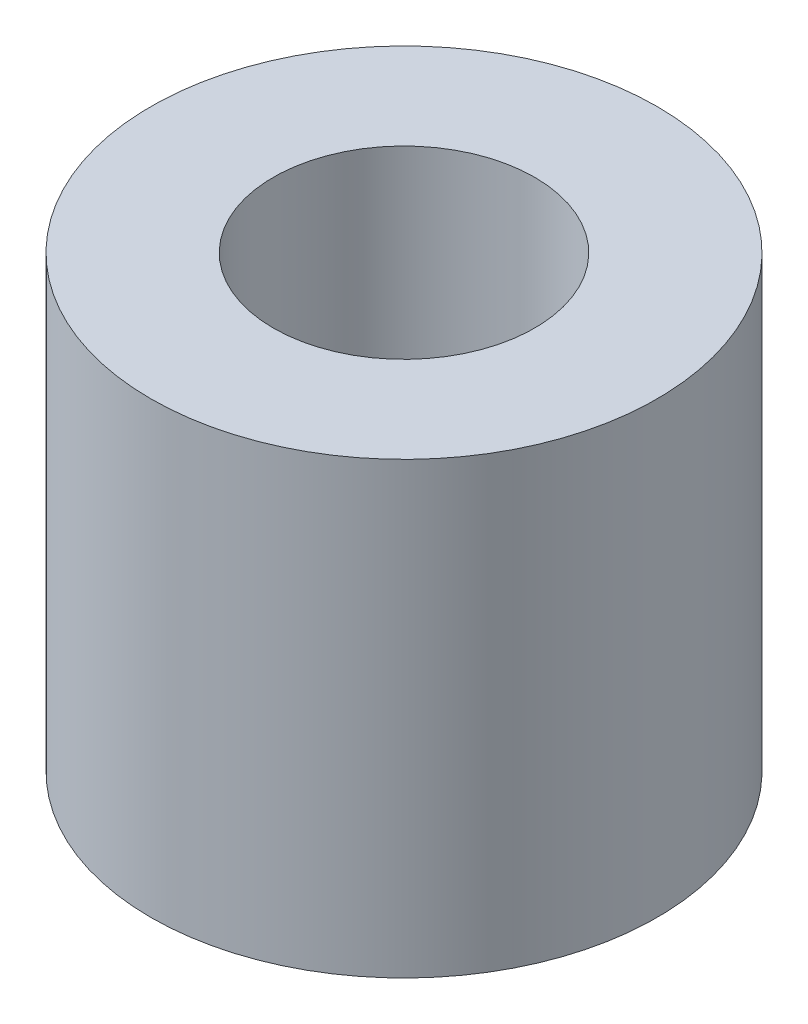
from build123d import *

# Parameters (mm, degrees)
SKETCH_1_R      = 3.1
SKETCH_1_R_2    = 1.6
EXTRUDE_1_DEPTH = 5.5


with BuildPart() as part:
    # 草图1 → 凸台-拉伸1 (new body)
    with BuildSketch(Plane(origin=(0, 0, 0), x_dir=(1, 0, 0), z_dir=(0, 1, 0))):
        with Locations(Location((0, 0, 0), (0, 0, 270))):
            Circle(SKETCH_1_R)
        with Locations(Location((0, 0, 0), (0, 0, 270))):
            Circle(SKETCH_1_R_2, mode=Mode.SUBTRACT)
    extrude(amount=EXTRUDE_1_DEPTH)


solid = part.part
